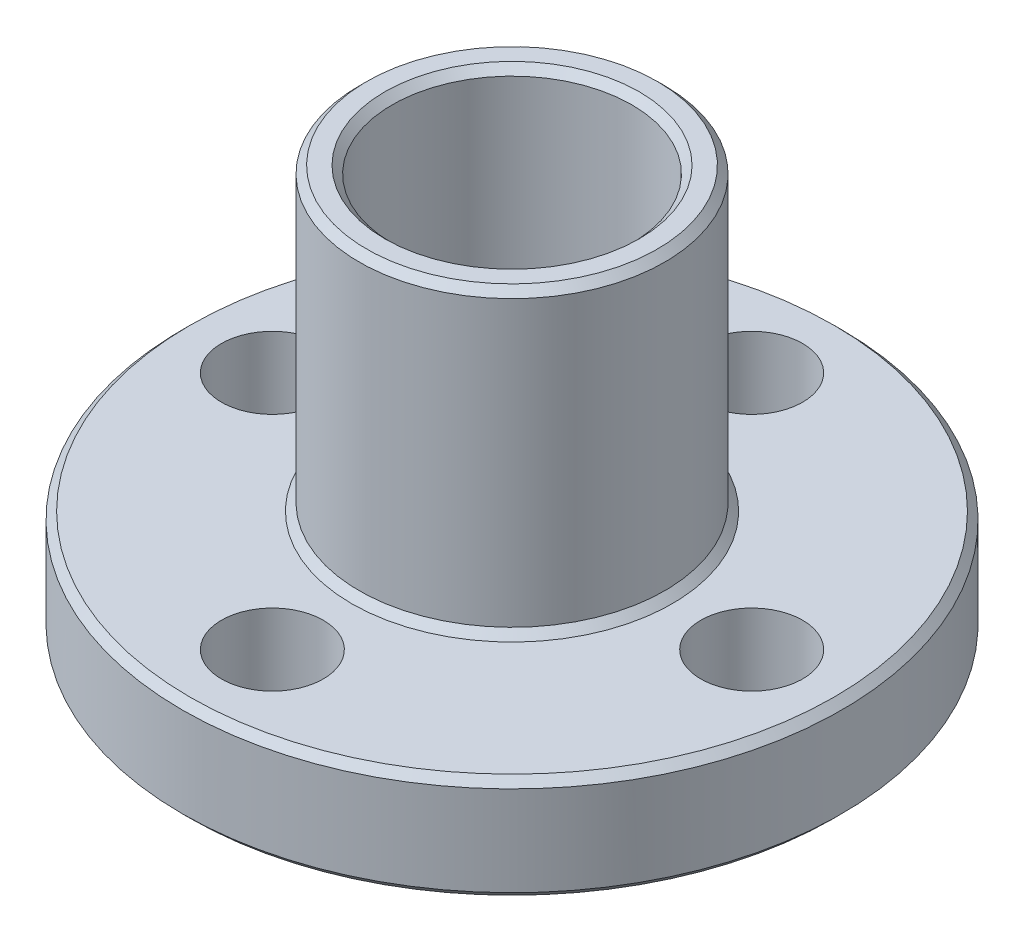
from build123d import *

# Parameters (mm, degrees)
CUT_EXTRUDE1_DEPTH       = 22.610182785
CUT_EXTRUDE1_DEPTH_BACK  = 22.610182785
SKETCH2_R                = 4
M3_CLEARANCE_HOLE1_D     = 3.4
M3_CLEARANCE_HOLE1_DEPTH = 10
M3_CLEARANCE_HOLE1_TIP   = 1.021463052
CHAMFER1_SIZE            = 0.25


with BuildPart() as part:
    # Sketch1 → Revolve1 (revolve)
    with BuildSketch(Plane.XY, mode=Mode.PRIVATE) as revolve1_sk:
        Polygon((0, 0), (5.1, 0), (5.1, 1.5), (11, 1.5), (11, 5), (5.1, 5), (5.1, 15), (0, 15), align=None)
    revolve(revolve1_sk.sketch.rotate(Axis((0, 0, 0), (0, -1, 0)), 90), axis=Axis((0, 0, 0), (0, -1, 0)))

    # Sketch2 → Cut-Extrude1 (cut, two sides: drawn at the far end of the back side and taken through both)
    with BuildSketch(Plane.XZ.offset(-CUT_EXTRUDE1_DEPTH_BACK)):
        with Locations(Location((0, 0, 0), (0, 0, 270))):
            Circle(SKETCH2_R)
    extrude(amount=CUT_EXTRUDE1_DEPTH + CUT_EXTRUDE1_DEPTH_BACK, mode=Mode.SUBTRACT)

    # M3 Clearance Hole1
    with Locations(Plane.XZ.offset(-1.5)):
        with Locations((0, 8), (8, 0), (0, -8), (-8, 0), (0, 0)):
            Hole(M3_CLEARANCE_HOLE1_D / 2, depth=M3_CLEARANCE_HOLE1_DEPTH)
            with Locations((0, 0, -(M3_CLEARANCE_HOLE1_DEPTH + M3_CLEARANCE_HOLE1_TIP / 2))):  # 118° drill point
                Cone(0, M3_CLEARANCE_HOLE1_D / 2, M3_CLEARANCE_HOLE1_TIP, mode=Mode.SUBTRACT)

    # Chamfer1
    chamfer1_edges = [part.edges().sort_by_distance(p)[0] for p in [
        (0, 15, 4),
        (0, 15, -5.1),
        (0, 5, -5.1),
        (0, 5, -11),
        (0, 1.5, -11),
        (0, 1.5, -5.1),
        (0, 0, -5.1),
    ]]
    chamfer(chamfer1_edges, length=CHAMFER1_SIZE)


solid = part.part
